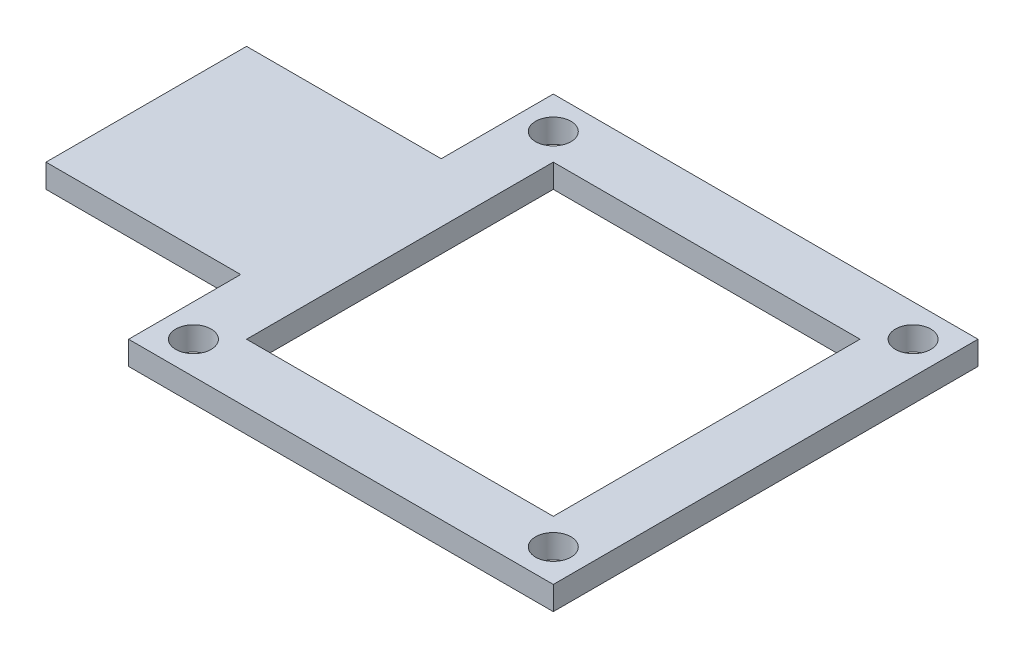
from build123d import *

# Parameters (mm, degrees)
CROQUIS1_W              = 16.5
CROQUIS1_H              = 17
CROQUIS1_R              = 1.5
CROQUIS1_W_2            = 5
SALIENTE_EXTRUIR1_DEPTH = 2


with BuildPart() as part:
    # Croquis1 → Saliente-Extruir1 (new body)
    # profile 1 of 3: a face of its own
    with BuildSketch(Plane(origin=(0, 0, 0), x_dir=(1, 0, 0), z_dir=(0, 1, 0))):
        with Locations((-26.25, 0)):
            Rectangle(CROQUIS1_W, CROQUIS1_H)
    # profile 2 of 3: a face of its own
    with BuildSketch(Plane(origin=(0, 0, 0), x_dir=(1, 0, 0), z_dir=(0, 1, 0))):
        Polygon((13, -13), (-13, -13), (-13, -8.5), (-18, -8.5), (-18, -18), (18, -18), (18, 18), (-18, 18), (-18, 8.5), (-13, 8.5), (-13, 13), (13, 13), align=None)
        with Locations(Location((-15.25, -15.25, 0), (0, 0, 270))):
            Circle(CROQUIS1_R, mode=Mode.SUBTRACT)
        with Locations(Location((15.25, -15.25, 0), (0, 0, 270))):
            Circle(CROQUIS1_R, mode=Mode.SUBTRACT)
        with Locations(Location((-15.25, 15.25, 0), (0, 0, 270))):
            Circle(CROQUIS1_R, mode=Mode.SUBTRACT)
        with Locations(Location((15.25, 15.25, 0), (0, 0, 270))):
            Circle(CROQUIS1_R, mode=Mode.SUBTRACT)
    # profile 3 of 3: a face of its own
    with BuildSketch(Plane(origin=(0, 0, 0), x_dir=(1, 0, 0), z_dir=(0, 1, 0))):
        with Locations((-15.5, 0)):
            Rectangle(CROQUIS1_W_2, CROQUIS1_H)
    extrude(amount=SALIENTE_EXTRUIR1_DEPTH)


solid = part.part
